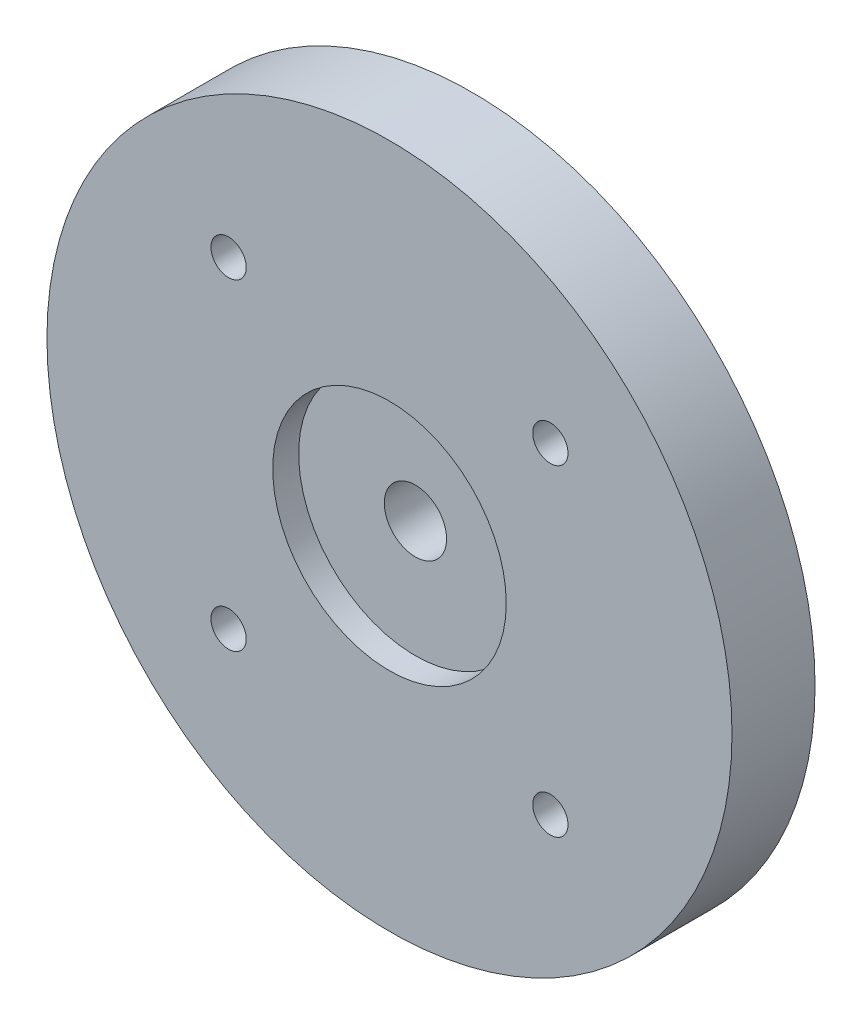
from build123d import *

# Parameters (mm, degrees)
SKETCH2_R               = 33
BOSS_EXTRUDE1_DEPTH     = 8
SKETCH6_R               = 10
BOSS_EXTRUDE2_DEPTH     = 2
CUT_EXTRUDE1_DEPTH      = 48.728398255
CUT_EXTRUDE1_DEPTH_BACK = 48.728398255
SKETCH3_R               = 1.7
SKETCH3_R_2             = 3
CUT_EXTRUDE2_DEPTH      = 48.349762407
CUT_EXTRUDE2_DEPTH_BACK = 2
SKETCH4_R               = 2.8
SKETCH5_R               = 2.1
CUT_EXTRUDE3_DEPTH      = 6
FILLET1_R               = 1
SKETCH7_R               = 11.25
CUT_EXTRUDE4_DEPTH      = 2.5


with BuildPart() as part:
    # Sketch2 → Boss-Extrude1 (new body)
    with BuildSketch(Plane.XY):
        Circle(SKETCH2_R)
    extrude(amount=BOSS_EXTRUDE1_DEPTH)

    # Sketch6 → Boss-Extrude2 (add)
    with BuildSketch(Plane(origin=(0, 0, 0), x_dir=(-1, 0, 0), z_dir=(0, 0, -1))):
        Circle(SKETCH6_R)
    extrude(amount=BOSS_EXTRUDE2_DEPTH)

    # Sketch3 → Cut-Extrude1 (cut, two sides: drawn at the far end of the back side and taken through both)
    with BuildSketch(Plane.XY.offset(8).offset(-CUT_EXTRUDE1_DEPTH_BACK)):
        with Locations((-15.5, 15.5)):
            Circle(SKETCH3_R)
        with Locations((15.5, 15.5)):
            Circle(SKETCH3_R)
        with Locations((15.5, -15.5)):
            Circle(SKETCH3_R)
        with Locations((-15.5, -15.5)):
            Circle(SKETCH3_R)
        Circle(SKETCH3_R_2)
    extrude(amount=CUT_EXTRUDE1_DEPTH + CUT_EXTRUDE1_DEPTH_BACK, mode=Mode.SUBTRACT)

    # Sketch4 → Cut-Extrude2 (cut, two sides: drawn at the far end of the back side and taken through both)
    with BuildSketch(Plane(origin=(0, 0, 0), x_dir=(-1, 0, 0), z_dir=(0, 0, -1)).offset(-CUT_EXTRUDE2_DEPTH_BACK)):
        with Locations(Location((-15.5, 15.5, 0), (0, 0, 180))):
            Circle(SKETCH4_R)
        with Locations(Location((15.5, 15.5, 0), (0, 0, 180))):
            Circle(SKETCH4_R)
        with Locations(Location((15.5, -15.5, 0), (0, 0, 180))):
            Circle(SKETCH4_R)
        with Locations(Location((-15.5, -15.5, 0), (0, 0, 180))):
            Circle(SKETCH4_R)
    extrude(amount=CUT_EXTRUDE2_DEPTH + CUT_EXTRUDE2_DEPTH_BACK, mode=Mode.SUBTRACT)

    # Sketch5 → Cut-Extrude3 (cut)
    with BuildSketch(Plane(origin=(0, 0, 0), x_dir=(-1, 0, 0), z_dir=(0, 0, -1))):
        with Locations((0, 29.5)):
            Circle(SKETCH5_R)
        with Locations((29.5, 0)):
            Circle(SKETCH5_R)
        with Locations((0, -29.5)):
            Circle(SKETCH5_R)
        with Locations((-29.5, 0)):
            Circle(SKETCH5_R)
    extrude(amount=-CUT_EXTRUDE3_DEPTH, mode=Mode.SUBTRACT)

    # Fillet1
    fillet1_edges = [part.edges().sort_by_distance(p)[0] for p in [
        (10, 0, 0),
    ]]
    fillet(fillet1_edges, radius=FILLET1_R)

    # Sketch7 → Cut-Extrude4 (cut)
    with BuildSketch(Plane.XY.offset(8)):
        Circle(SKETCH7_R)
    extrude(amount=-CUT_EXTRUDE4_DEPTH, mode=Mode.SUBTRACT)


solid = part.part
